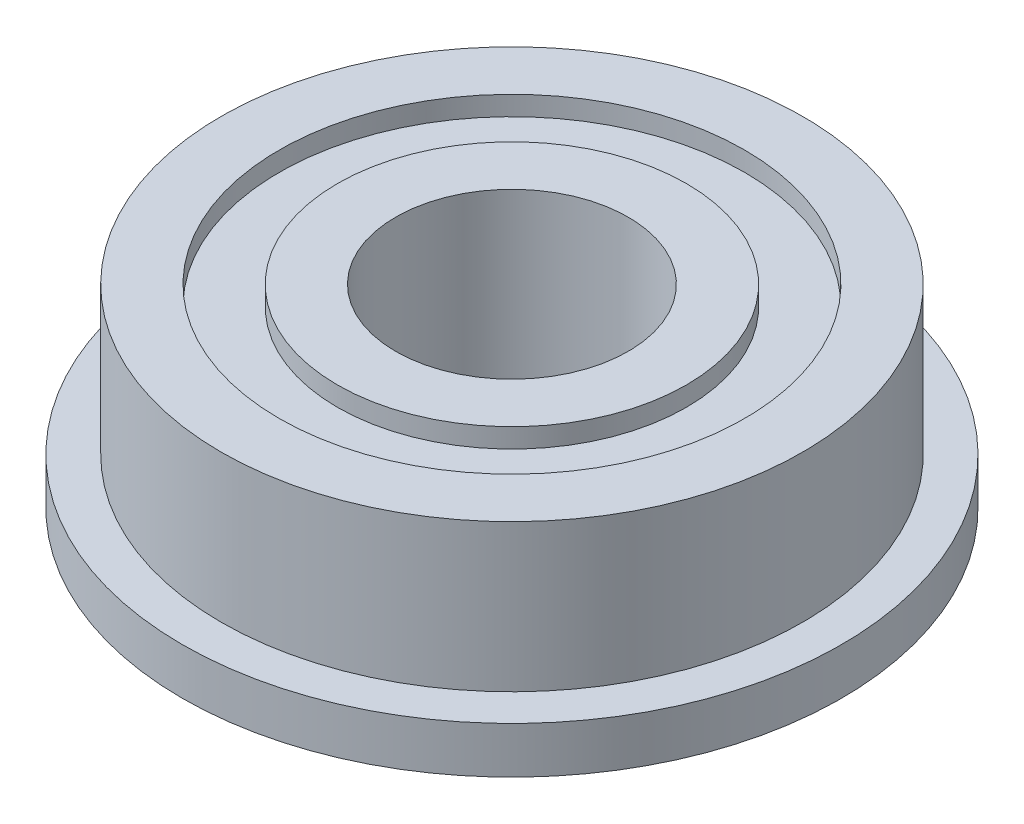
from build123d import *


with BuildPart() as part:
    # 草图1 → 旋转1 (revolve)
    with BuildSketch(Plane.XY, mode=Mode.PRIVATE) as revolve_1_sk:
        Polygon((3, 0), (3, 5), (4.5, 5), (4.5, 4.5), (6, 4.5), (6, 5), (7.5, 5), (7.5, 1.2), (8.5, 1.2), (8.5, 0), (6, 0), (6, 0.5), (4.5, 0.5), (4.5, 0), align=None)
    revolve(revolve_1_sk.sketch.rotate(Axis((0, 7.209432939, 0), (0, -1, 0)), 90), axis=Axis((0, 7.209432939, 0), (0, -1, 0)))


solid = part.part
